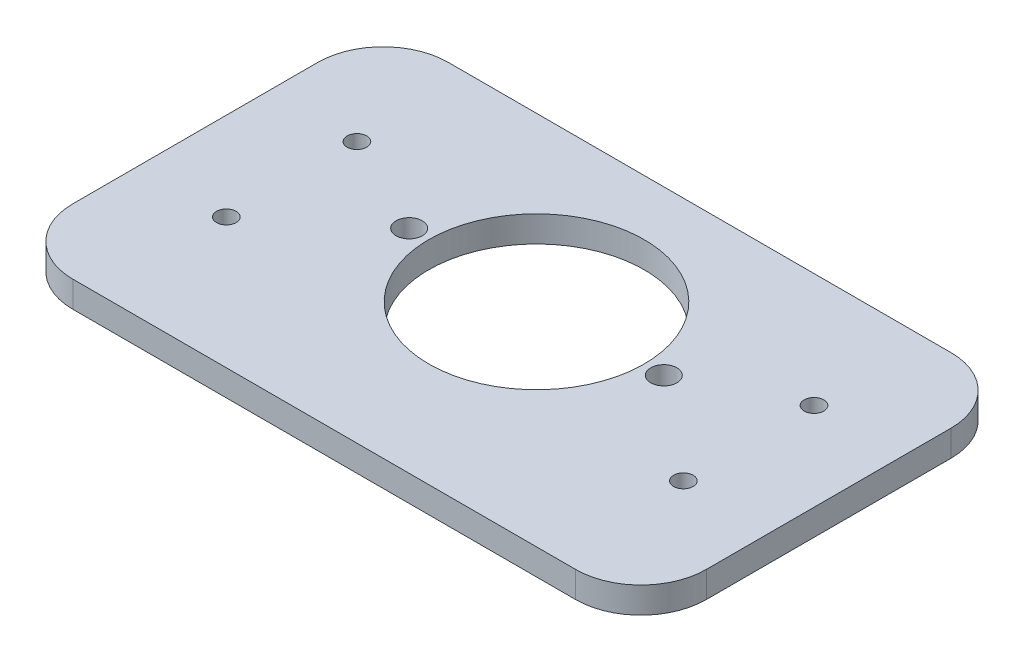
from build123d import *

# Parameters (mm, degrees)
SKETCH_1_W          = 97
SKETCH_1_H          = 57.5
SKETCH_1_R          = 16.5
SKETCH_1_R_2        = 2
EXTRUDE_1_DEPTH     = 4
FILLET_1_R          = 10
SKETCH_2_R          = 1.5
CUT_EXTRUDE_1_DEPTH = 10


with BuildPart() as part:
    # Эскиз1 → Бобышка-Вытянуть1 (new body)
    with BuildSketch(Plane(origin=(0, 0, 0), x_dir=(1, 0, 0), z_dir=(0, 1, 0))):
        with Locations((48.5, 28.75)):
            Rectangle(SKETCH_1_W, SKETCH_1_H)
        with Locations(Location((48.5, 32.5, 0), (0, 0, 270))):
            Circle(SKETCH_1_R, mode=Mode.SUBTRACT)
        with Locations(Location((29, 32.5, 0), (0, 0, 270))):
            Circle(SKETCH_1_R_2, mode=Mode.SUBTRACT)
        with Locations(Location((68, 32.5, 0), (0, 0, 90))):
            Circle(SKETCH_1_R_2, mode=Mode.SUBTRACT)
    extrude(amount=EXTRUDE_1_DEPTH)

    # Скругление1
    fillet_1_edges = [part.edges().sort_by_distance(p)[0] for p in [
        (0, 2, -57.5),
        (97, 2, -57.5),
        (97, 2, 0),
        (0, 2, 0),
    ]]
    fillet(fillet_1_edges, radius=FILLET_1_R)

    # Эскиз2 → Вырез-Вытянуть1 (cut)
    with BuildSketch(Plane(origin=(0, 4, 0), x_dir=(1, 0, 0), z_dir=(0, 1, 0))):
        with Locations(Location((13.5, 20, 0), (0, 0, 270))):
            Circle(SKETCH_2_R)
        with Locations(Location((13.5, 40, 0), (0, 0, 270))):
            Circle(SKETCH_2_R)
        with Locations(Location((83.5, 40, 0), (0, 0, 90))):
            Circle(SKETCH_2_R)
        with Locations(Location((83.5, 20, 0), (0, 0, 90))):
            Circle(SKETCH_2_R)
    extrude(amount=-CUT_EXTRUDE_1_DEPTH, mode=Mode.SUBTRACT)


solid = part.part
